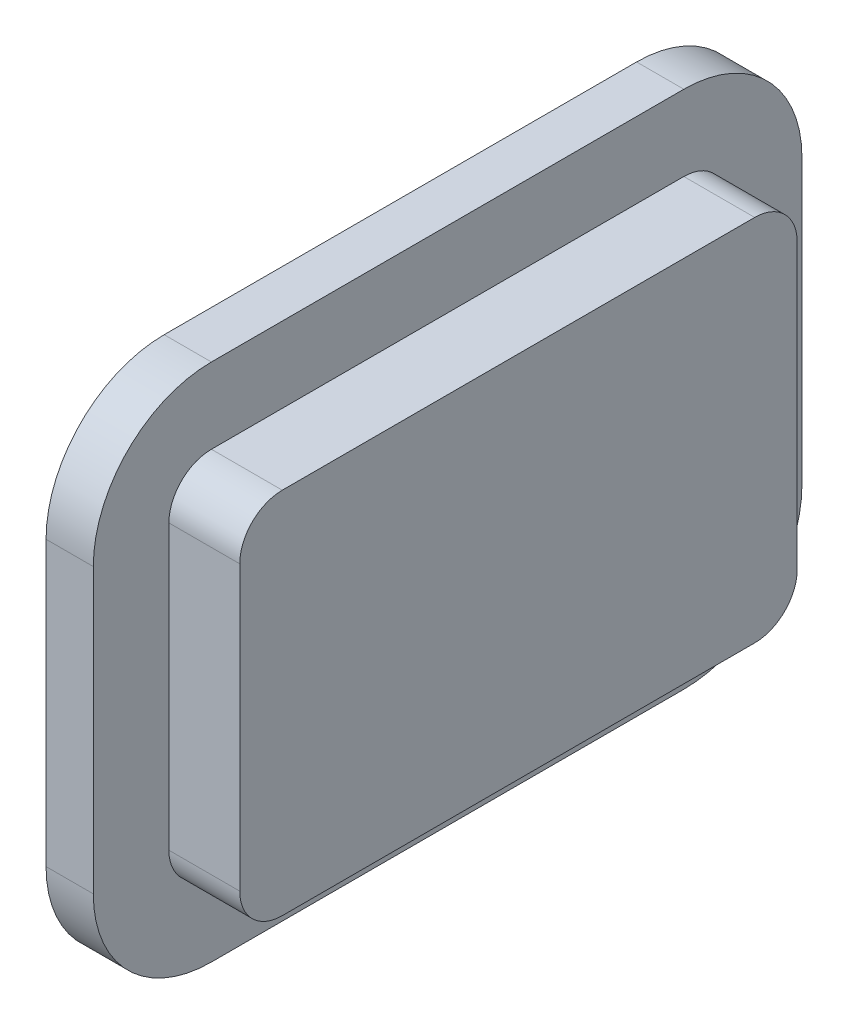
from build123d import *

# Parameters (mm, degrees)
BOSS_EXTRUDE1_DEPTH = 1
BOSS_EXTRUDE2_DEPTH = 1.5


with BuildPart() as part:
    # Sketch1 → Boss-Extrude1 (new body)
    with BuildSketch(Plane.ZY.offset(60)):
        with BuildLine():
            Line((-36.32233047, 7.85), (-26.32233047, 7.85))
            ThreePointArc((-26.32233047, 7.85), (-24.554563517, 8.582233047), (-23.82233047, 10.35))
            Line((-23.82233047, 10.35), (-23.82233047, 16.35))
            ThreePointArc((-23.82233047, 16.35), (-24.554563517, 18.117766953), (-26.32233047, 18.85))
            Line((-26.32233047, 18.85), (-36.32233047, 18.85))
            ThreePointArc((-36.32233047, 18.85), (-38.090097423, 18.117766953), (-38.82233047, 16.35))
            Line((-38.82233047, 16.35), (-38.82233047, 10.35))
            ThreePointArc((-38.82233047, 10.35), (-38.090097423, 8.582233047), (-36.32233047, 7.85))
        make_face()
    extrude(amount=BOSS_EXTRUDE1_DEPTH)

    # Sketch1<3> → Boss-Extrude2 (add)
    with BuildSketch(Plane.ZY.offset(60)):
        with BuildLine():
            Line((-36.32233047, 9.45), (-26.32233047, 9.45))
            ThreePointArc((-26.32233047, 9.45), (-25.685934367, 9.713603897), (-25.42233047, 10.35))
            Line((-25.42233047, 10.35), (-25.42233047, 16.35))
            ThreePointArc((-25.42233047, 16.35), (-25.685934367, 16.986396103), (-26.32233047, 17.25))
            Line((-26.32233047, 17.25), (-36.32233047, 17.25))
            ThreePointArc((-36.32233047, 17.25), (-36.958726573, 16.986396103), (-37.22233047, 16.35))
            Line((-37.22233047, 16.35), (-37.22233047, 10.35))
            ThreePointArc((-37.22233047, 10.35), (-36.958726573, 9.713603897), (-36.32233047, 9.45))
        make_face()
    extrude(amount=-BOSS_EXTRUDE2_DEPTH)


solid = part.part
